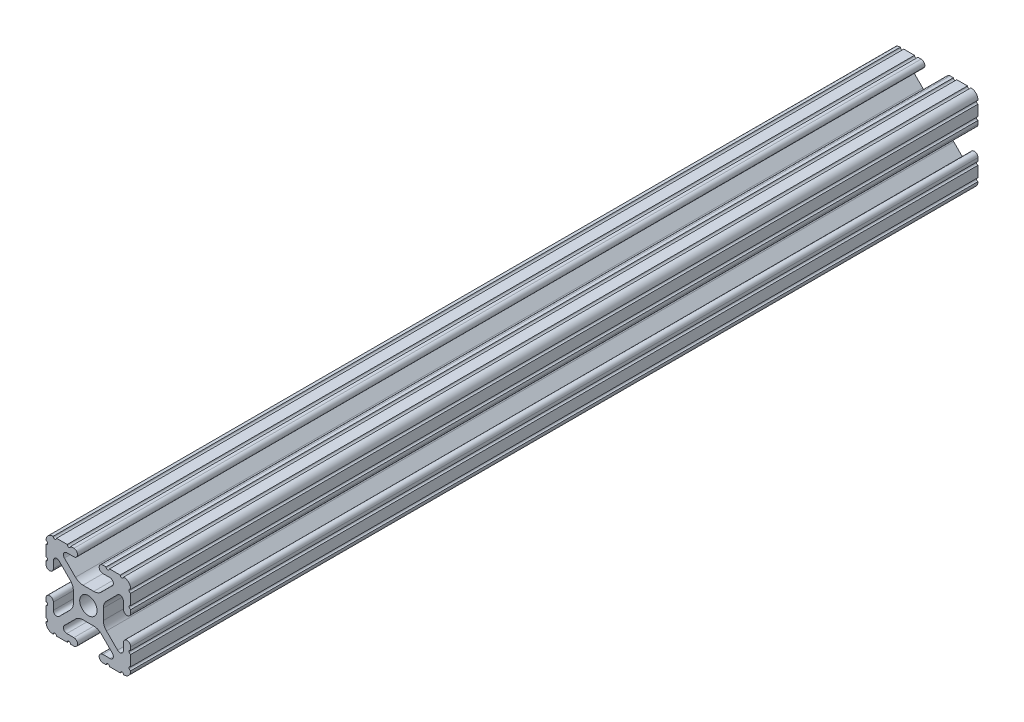
from build123d import *

# Parameters (mm, degrees)
SKETCH1_R           = 2.6035
BOSS_EXTRUDE1_DEPTH = 254


with BuildPart() as part:
    # Sketch1 → Boss-Extrude1 (new body)
    with BuildSketch(Plane(origin=(0, 0, -25.4), x_dir=(-1, 0, 0), z_dir=(0, 0, -1))):
        with BuildLine():
            Line((12.7, -9.5504), (12.7, -6.3330836))
            ThreePointArc((12.7, -6.3330836), (12.192, -5.8250836), (12.7, -5.3170836))
            Line((12.7, -5.3170836), (12.7, -4.3434))
            ThreePointArc((12.7, -4.3434), (11.5951, -3.2385), (10.4902, -4.3434))
            Line((10.4902, -4.3434), (10.4902, -6.474794456))
            ThreePointArc((10.4902, -6.474794456), (9.863006367, -7.413456061), (8.75577951, -7.193214945))
            Line((8.75577951, -7.193214945), (5.42573597, -3.863171405))
            ThreePointArc((5.42573597, -3.863171405), (4.737482484, -2.833127272), (4.4958, -1.618107374))
            Line((4.4958, -1.618107374), (4.4958, 1.618107374))
            ThreePointArc((4.4958, 1.618107374), (4.737482484, 2.833127272), (5.42573597, 3.863171405))
            Line((5.42573597, 3.863171405), (8.75577951, 7.193214945))
            ThreePointArc((8.75577951, 7.193214945), (9.863006367, 7.413456061), (10.4902, 6.474794456))
            Line((10.4902, 6.474794456), (10.4902, 4.343399971))
            ThreePointArc((10.4902, 4.343399971), (11.5951, 3.238499971), (12.7, 4.343399971))
            Line((12.7, 4.343399971), (12.7, 5.3170836))
            ThreePointArc((12.7, 5.3170836), (12.192, 5.8250836), (12.7, 6.3330836))
            Line((12.7, 6.3330836), (12.7, 9.5504))
            ThreePointArc((12.7, 9.5504), (12.192000006, 10.058323491), (12.699846982, 10.566399977))
            ThreePointArc((12.699846982, 10.566399977), (12.082522516, 12.082522516), (10.566399977, 12.699846982))
            ThreePointArc((10.566399977, 12.699846982), (10.058323491, 12.192000006), (9.5504, 12.7))
            Line((9.5504, 12.7), (6.3330836, 12.7))
            ThreePointArc((6.3330836, 12.7), (5.8250836, 12.192), (5.3170836, 12.7))
            Line((5.3170836, 12.7), (4.3434, 12.7))
            ThreePointArc((4.3434, 12.7), (3.2385, 11.5951), (4.3434, 10.4902))
            Line((4.3434, 10.4902), (6.474794456, 10.4902))
            ThreePointArc((6.474794456, 10.4902), (7.413456061, 9.863006367), (7.193214945, 8.75577951))
            Line((7.193214945, 8.75577951), (3.863171405, 5.42573597))
            ThreePointArc((3.863171405, 5.42573597), (2.833127272, 4.737482484), (1.618107374, 4.4958))
            Line((1.618107374, 4.4958), (-1.618107374, 4.4958))
            ThreePointArc((-1.618107374, 4.4958), (-2.833127272, 4.737482484), (-3.863171405, 5.42573597))
            Line((-3.863171405, 5.42573597), (-7.193214945, 8.75577951))
            ThreePointArc((-7.193214945, 8.75577951), (-7.413456061, 9.863006367), (-6.474794456, 10.4902))
            Line((-6.474794456, 10.4902), (-4.343399971, 10.4902))
            ThreePointArc((-4.343399971, 10.4902), (-3.238499971, 11.5951), (-4.343399971, 12.7))
            Line((-4.343399971, 12.7), (-5.3170836, 12.7))
            ThreePointArc((-5.3170836, 12.7), (-5.8250836, 12.192), (-6.3330836, 12.7))
            Line((-6.3330836, 12.7), (-9.5504, 12.7))
            ThreePointArc((-9.5504, 12.7), (-10.058323491, 12.192000006), (-10.566399977, 12.699846982))
            ThreePointArc((-10.566399977, 12.699846982), (-12.082522516, 12.082522516), (-12.699846982, 10.566399977))
            ThreePointArc((-12.699846982, 10.566399977), (-12.192000006, 10.058323491), (-12.7, 9.5504))
            Line((-12.7, 9.5504), (-12.7, 6.3330836))
            ThreePointArc((-12.7, 6.3330836), (-12.192, 5.8250836), (-12.7, 5.3170836))
            Line((-12.7, 5.3170836), (-12.7, 4.3434))
            ThreePointArc((-12.7, 4.3434), (-11.5951, 3.2385), (-10.4902, 4.3434))
            Line((-10.4902, 4.3434), (-10.4902, 6.474794456))
            ThreePointArc((-10.4902, 6.474794456), (-9.863006367, 7.413456061), (-8.75577951, 7.193214945))
            Line((-8.75577951, 7.193214945), (-5.42573597, 3.863171405))
            ThreePointArc((-5.42573597, 3.863171405), (-4.737482484, 2.833127272), (-4.4958, 1.618107374))
            Line((-4.4958, 1.618107374), (-4.4958, -1.618107374))
            ThreePointArc((-4.4958, -1.618107374), (-4.737482484, -2.833127272), (-5.42573597, -3.863171405))
            Line((-5.42573597, -3.863171405), (-8.75577951, -7.193214945))
            ThreePointArc((-8.75577951, -7.193214945), (-9.863006367, -7.413456061), (-10.4902, -6.474794456))
            Line((-10.4902, -6.474794456), (-10.4902, -4.343399971))
            ThreePointArc((-10.4902, -4.343399971), (-11.5951, -3.238499971), (-12.7, -4.343399971))
            Line((-12.7, -4.343399971), (-12.7, -5.3170836))
            ThreePointArc((-12.7, -5.3170836), (-12.192, -5.8250836), (-12.7, -6.3330836))
            Line((-12.7, -6.3330836), (-12.7, -9.5504))
            ThreePointArc((-12.7, -9.5504), (-12.192000006, -10.058323491), (-12.699846982, -10.566399977))
            ThreePointArc((-12.699846982, -10.566399977), (-12.082522516, -12.082522516), (-10.566399977, -12.699846982))
            ThreePointArc((-10.566399977, -12.699846982), (-10.058323491, -12.192000006), (-9.5504, -12.7))
            Line((-9.5504, -12.7), (-6.3330836, -12.7))
            ThreePointArc((-6.3330836, -12.7), (-5.8250836, -12.192), (-5.3170836, -12.7))
            Line((-5.3170836, -12.7), (-4.3434, -12.7))
            ThreePointArc((-4.3434, -12.7), (-3.2385, -11.5951), (-4.3434, -10.4902))
            Line((-4.3434, -10.4902), (-6.474794456, -10.4902))
            ThreePointArc((-6.474794456, -10.4902), (-7.413456061, -9.863006367), (-7.193214945, -8.75577951))
            Line((-7.193214945, -8.75577951), (-3.863171405, -5.42573597))
            ThreePointArc((-3.863171405, -5.42573597), (-2.833127272, -4.737482484), (-1.618107374, -4.4958))
            Line((-1.618107374, -4.4958), (1.618107374, -4.4958))
            ThreePointArc((1.618107374, -4.4958), (2.833127272, -4.737482484), (3.863171405, -5.42573597))
            Line((3.863171405, -5.42573597), (7.193214945, -8.75577951))
            ThreePointArc((7.193214945, -8.75577951), (7.413456061, -9.863006367), (6.474794456, -10.4902))
            Line((6.474794456, -10.4902), (4.343399971, -10.4902))
            ThreePointArc((4.343399971, -10.4902), (3.238499971, -11.5951), (4.343399971, -12.7))
            Line((4.343399971, -12.7), (5.3170836, -12.7))
            ThreePointArc((5.3170836, -12.7), (5.8250836, -12.192), (6.3330836, -12.7))
            Line((6.3330836, -12.7), (9.5504, -12.7))
            ThreePointArc((9.5504, -12.7), (10.058323491, -12.192000006), (10.566399977, -12.699846982))
            ThreePointArc((10.566399977, -12.699846982), (12.082522516, -12.082522516), (12.699846982, -10.566399977))
            ThreePointArc((12.699846982, -10.566399977), (12.192000006, -10.058323491), (12.7, -9.5504))
        make_face()
        with Locations(Location((0, 0, 0), (0, 0, 180))):
            Circle(SKETCH1_R, mode=Mode.SUBTRACT)
    extrude(amount=-BOSS_EXTRUDE1_DEPTH)


solid = part.part
